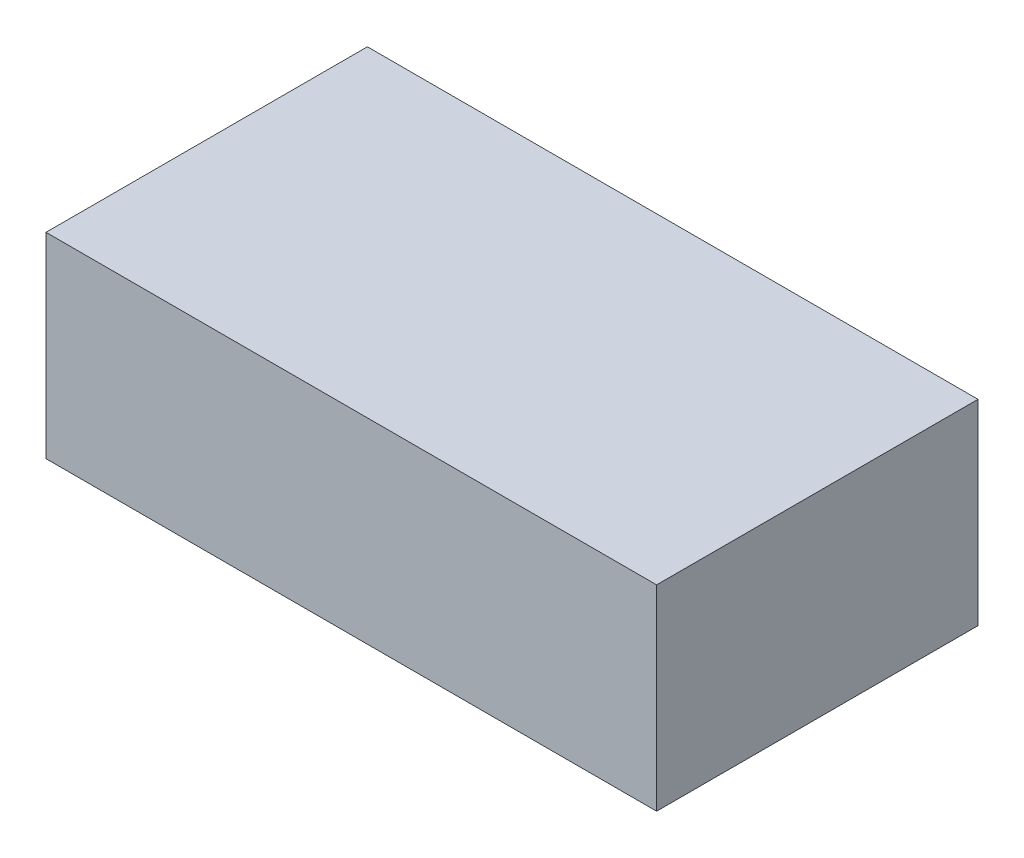
from build123d import *

# Parameters (mm, degrees)
SKETCH1_W           = 48.26
SKETCH1_H           = 25.4
BOSS_EXTRUDE1_DEPTH = 15.494


with BuildPart() as part:
    # Sketch1 → Boss-Extrude1 (new body)
    with BuildSketch(Plane(origin=(0, 0, 0), x_dir=(1, 0, 0), z_dir=(0, 1, 0))):
        with Locations((-24.13, -12.7)):
            Rectangle(SKETCH1_W, SKETCH1_H)
    extrude(amount=BOSS_EXTRUDE1_DEPTH)


solid = part.part
